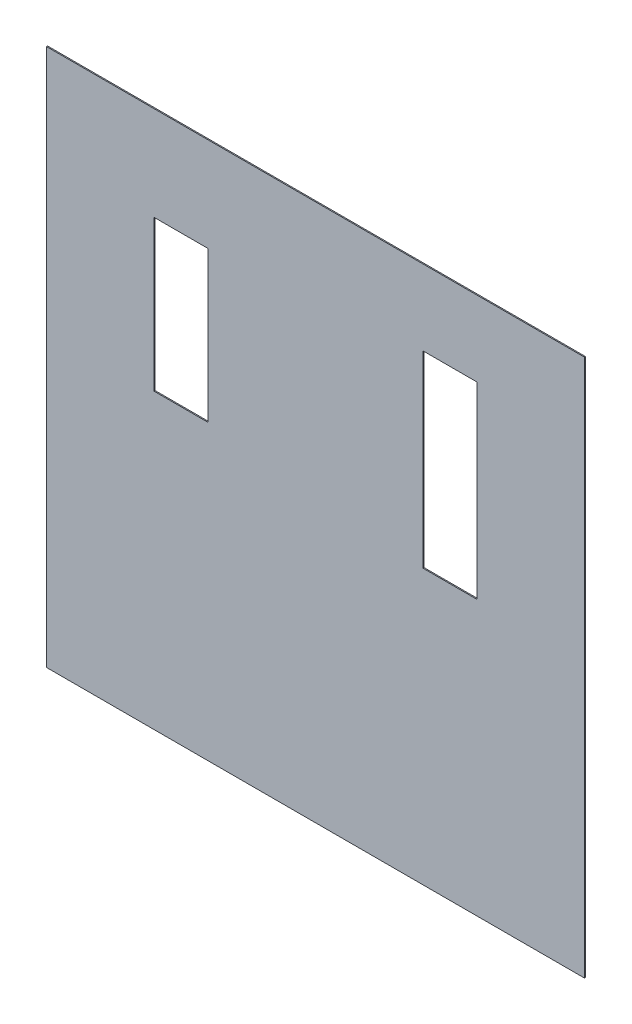
from build123d import *

# Parameters (mm, degrees)
SKETCH1_W           = 25.4
SKETCH1_H           = 25.4
BOSS_EXTRUDE1_DEPTH = 0.0508
SKETCH2_W           = 2.54
SKETCH2_H           = 7.112
SKETCH2_H_2         = 8.89
CUT_EXTRUDE1_DEPTH  = 36.921060405


with BuildPart() as part:
    # Sketch1 → Boss-Extrude1 (new body)
    with BuildSketch(Plane.XY):
        with Locations((12.7, 12.7)):
            Rectangle(SKETCH1_W, SKETCH1_H)
    extrude(amount=BOSS_EXTRUDE1_DEPTH)

    # Sketch2 → Cut-Extrude1 (cut, through all)
    with BuildSketch(Plane.XY.offset(0.0508)):
        with Locations((6.35, 17.399)):
            Rectangle(SKETCH2_W, SKETCH2_H)
        with Locations((19.05, 17.399)):
            Rectangle(SKETCH2_W, SKETCH2_H_2)
    extrude(amount=-CUT_EXTRUDE1_DEPTH, mode=Mode.SUBTRACT)


solid = part.part
